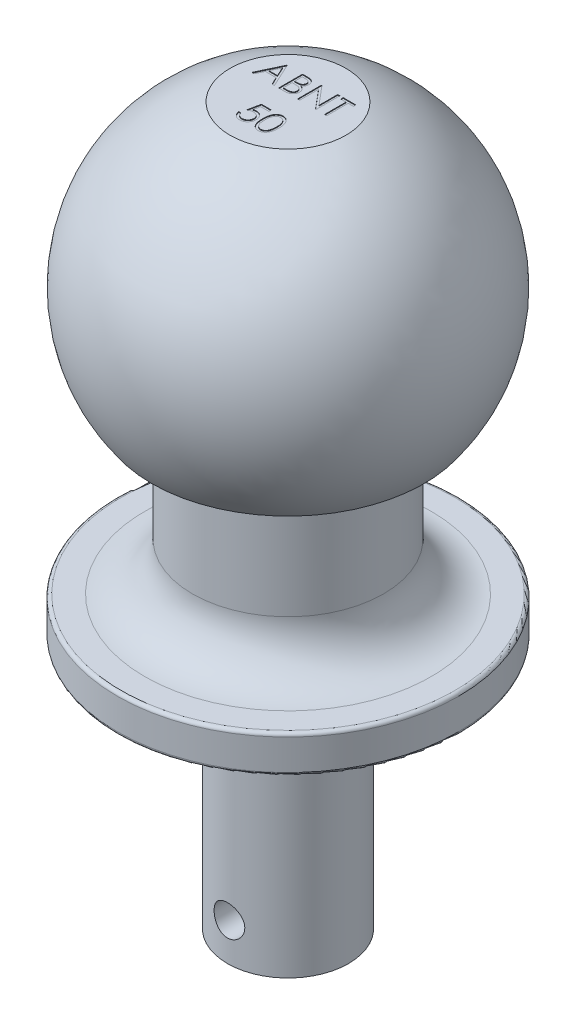
from build123d import *

# Parameters (mm, degrees)
FILETE1_R                = 3
FILETE2_R                = 7
FILETE3_R                = 0.5
FILETE4_R                = 1
CHANFRO1_SIZE            = 1
ESBO_O3_W                = 22.678918952
ESBO_O3_H                = 21.57737146
RESSALTO_EXTRUS_O3_DEPTH = 15
ESBO_O4_R                = 2.25
CORTE_EXTRUS_O1_DEPTH    = 106.463602561
CORTE_EXTRUS_O2_START    = -17.75
ESBO_O5_W                = 26.437139808
ESBO_O5_H                = 26.113155252
ESBO_O5_R                = 8.875
CORTE_EXTRUS_O2_DEPTH    = 17.75
CORTE_EXTRUS_O3_DEPTH    = 0.1


with BuildPart() as part:
    # Esboço1 → Revolução1 (revolve)
    with BuildSketch(Plane.XY, mode=Mode.PRIVATE) as revolu_o1_sk:
        with BuildLine():
            Line((8.5, 8.996138417), (0, 8.996138417))
            Line((0, 8.996138417), (0, -96.003861583))
            Line((0, -96.003861583), (8.875, -96.003861583))
            Line((8.875, -96.003861583), (8.875, -65.003861583))
            Line((8.875, -65.003861583), (9, -65.003861583))
            Line((9, -65.003861583), (9, -59.003861583))
            Line((9, -59.003861583), (25, -59.003861583))
            Line((25, -59.003861583), (25, -53.503861583))
            Line((25, -53.503861583), (14, -53.503861583))
            Line((14, -53.503861583), (14, -29.503861583))
            Line((14, -29.503861583), (19.970638945, -29.503861583))
            ThreePointArc((19.970638945, -29.503861583), (23.929846164, -7.365487157), (8.5, 8.996138417))
        make_face()
    revolve(revolu_o1_sk.sketch.rotate(Axis((0, 76.868050941, 0), (0, -1, 0)), 90), axis=Axis((0, 76.868050941, 0), (0, -1, 0)))

    # Filete1
    filete1_edges = [part.edges().sort_by_distance(p)[0] for p in [
        (0, -29.503861583, -14),
    ]]
    fillet(filete1_edges, radius=FILETE1_R)

    # Filete2
    filete2_edges = [part.edges().sort_by_distance(p)[0] for p in [
        (0, -53.503861583, -14),
    ]]
    fillet(filete2_edges, radius=FILETE2_R)

    # Filete3
    filete3_edges = [part.edges().sort_by_distance(p)[0] for p in [
        (0, -53.503861583, -25),
        (0, -59.003861583, -25),
    ]]
    fillet(filete3_edges, radius=FILETE3_R)

    # Filete4
    filete4_edges = [part.edges().sort_by_distance(p)[0] for p in [
        (0, -59.003861583, -9),
    ]]
    fillet(filete4_edges, radius=FILETE4_R)

    # Chanfro1
    chanfro1_edges = [part.edges().sort_by_distance(p)[0] for p in [
        (0, -96.003861583, -8.875),
    ]]
    chamfer(chanfro1_edges, length=CHANFRO1_SIZE)

    # Esboço3 → Ressalto-extrusão3 (add)
    with BuildSketch(Plane.XZ.offset(96.003861583)):
        Rectangle(ESBO_O3_W, ESBO_O3_H)
    extrude(amount=-RESSALTO_EXTRUS_O3_DEPTH)

    # Esboço4 → Corte-extrusão1 (cut, through all)
    with BuildSketch(Plane.XY.offset(10.78868573)):
        with Locations((0, -90.503861583)):
            Circle(ESBO_O4_R)
    extrude(amount=-CORTE_EXTRUS_O1_DEPTH, mode=Mode.SUBTRACT)

    # Esboço5 → Corte-extrusão2 (cut)
    with BuildSketch(Plane.XZ.offset(96.003861583).offset(CORTE_EXTRUS_O2_START)):
        Rectangle(ESBO_O5_W, ESBO_O5_H)
        with Locations(Location((0, 0, 0), (0, 0, 90))):
            Circle(ESBO_O5_R, mode=Mode.SUBTRACT)
    extrude(amount=CORTE_EXTRUS_O2_DEPTH, mode=Mode.SUBTRACT)

    # Esboço2 → Corte-extrusão3 (cut)
    # profile 1 of 6: a face of its own
    with BuildSketch(Plane(origin=(0, 8.996138417, 0), x_dir=(1, 0, 0), z_dir=(0, 1, 0))):
        Polygon((-4.684544015, 4.57411413), (-3.0691594, 1.07411413), (-3.410605714, 1.07411413), (-3.928033598, 2.195909001), (-5.51467222, 2.195909001), (-6.046823662, 1.07411413), (-6.38967222, 1.07411413), (-4.72941581, 4.57411413), align=None)
        Polygon((-4.710485521, 3.891922623), (-5.344299624, 2.55488336), (-4.093498342, 2.55488336), align=None, mode=Mode.SUBTRACT)
    # profile 2 of 6: a face of its own
    with BuildSketch(Plane(origin=(0, 8.996138417, 0), x_dir=(1, 0, 0), z_dir=(0, 1, 0))):
        with BuildLine():
            Line((-2.440954271, 4.57411413), (-1.758061643, 4.57411413))
            add(Edge.make_bspline(
                [(-1.758061643, 4.57411413), (-1.724633165, 4.573938379), (-1.659840455, 4.573597731), (-1.565621013, 4.5683146), (-1.477372202, 4.56111093), (-1.39506843, 4.549680838), (-1.318747727, 4.53588906), (-1.24818009, 4.519187244), (-1.183589918, 4.499160631), (-1.106477182, 4.467314349), (-1.018556521, 4.419991181), (-0.923358128, 4.350062616), (-0.841953889, 4.264530153), (-0.771767571, 4.168047497), (-0.715966452, 4.061911726), (-0.675597154, 3.948652537), (-0.650039279, 3.829730795), (-0.647410845, 3.748087617), (-0.646082477, 3.706826469)],
                knots=[0, 0, 0, 0, 1.001505555, 1.941167018, 2.826882275, 3.653841531, 4.429895133, 5.150066043, 5.825578002, 6.45369114, 7.647487171, 8.808567382, 9.977351308, 11.170798116, 12.373658725, 13.556498008, 14.765093433, 16, 16, 16, 16], degree=3))
            add(Edge.make_bspline(
                [(-0.646082477, 3.706826469), (-0.647175695, 3.668173914), (-0.649323972, 3.592217997), (-0.669866732, 3.481123887), (-0.7020274, 3.375372669), (-0.746732649, 3.275350283), (-0.804834645, 3.18331667), (-0.873692964, 3.098529404), (-0.956769767, 3.024578347), (-1.019013007, 2.983235444), (-1.050629752, 2.962235123)],
                knots=[0, 0, 0, 0, 1.044552857, 2.05264487, 3.044412934, 4.028983338, 5.005914585, 5.980388656, 6.974128949, 8, 8, 8, 8], degree=3))
            add(Edge.make_bspline(
                [(-1.050629752, 2.962235123), (-1.010869325, 2.946970124), (-0.934797777, 2.9177644), (-0.830111765, 2.866128936), (-0.73991692, 2.809966826), (-0.663519774, 2.748634975), (-0.598182119, 2.682526165), (-0.541129177, 2.61067105), (-0.492447803, 2.532132292), (-0.45073488, 2.447728757), (-0.418186124, 2.358322289), (-0.393810219, 2.264751513), (-0.37984277, 2.167351957), (-0.377855129, 2.101066578), (-0.376851707, 2.067603713)],
                knots=[0, 0, 0, 0, 1.27268992, 2.434971085, 3.483601985, 4.442670788, 5.356604649, 6.2567628, 7.179492994, 8.113709626, 9.066344395, 10.018646069, 10.999752585, 12, 12, 12, 12], degree=3))
            add(Edge.make_bspline(
                [(-0.376851707, 2.067603713), (-0.377828553, 2.033436841), (-0.379750525, 1.966212563), (-0.393930497, 1.867457428), (-0.417939604, 1.773082482), (-0.45101075, 1.682477299), (-0.494173065, 1.595817164), (-0.546701029, 1.5130039), (-0.609332593, 1.43486957), (-0.679395462, 1.360545947), (-0.758657607, 1.293718159), (-0.844173362, 1.234202453), (-0.937019682, 1.185256391), (-1.035671676, 1.144140369), (-1.141235992, 1.112733171), (-1.2532386, 1.090760597), (-1.371582902, 1.07595556), (-1.452792653, 1.074738355), (-1.494439848, 1.07411413)],
                knots=[0, 0, 0, 0, 0.978564426, 1.925352924, 2.850884081, 3.763762016, 4.682927383, 5.618979971, 6.567305752, 7.547517671, 8.540179244, 9.531824382, 10.526200242, 11.540722885, 12.589160233, 13.674978461, 14.80764778, 16, 16, 16, 16], degree=3))
            Line((-1.494439848, 1.07411413), (-2.440954271, 1.07411413))
            Line((-2.440954271, 1.07411413), (-2.440954271, 4.57411413))
        make_face()
        with BuildLine():
            Line((-2.126851707, 4.215139771), (-2.126851707, 3.093344899))
            Line((-2.126851707, 3.093344899), (-1.915814047, 3.093344899))
            add(Edge.make_bspline(
                [(-1.915814047, 3.093344899), (-1.884965252, 3.093744822), (-1.825359092, 3.094517555), (-1.739039196, 3.096731072), (-1.658914178, 3.102929115), (-1.585122345, 3.109125377), (-1.517779901, 3.119199965), (-1.457036039, 3.131192088), (-1.401937442, 3.143874993), (-1.338397897, 3.16544448), (-1.266324948, 3.197322155), (-1.189491844, 3.246793991), (-1.121757374, 3.305718344), (-1.064560187, 3.373709306), (-1.017748716, 3.448575492), (-0.985235001, 3.529122372), (-0.963187717, 3.613342504), (-0.961196186, 3.671160757), (-0.960185041, 3.700516373)],
                knots=[0, 0, 0, 0, 1.156816544, 2.235205308, 3.236616184, 4.169592532, 5.011045266, 5.787822928, 6.49130361, 7.128639758, 8.301311294, 9.436451833, 10.541879658, 11.654887649, 12.756523258, 13.837046038, 14.901820046, 16, 16, 16, 16], degree=3))
            add(Edge.make_bspline(
                [(-0.960185041, 3.700516373), (-0.960711221, 3.719942145), (-0.961743381, 3.758047917), (-0.970196683, 3.813597271), (-0.984564258, 3.865841024), (-1.003018551, 3.915495134), (-1.02880724, 3.961006984), (-1.059170703, 4.00395018), (-1.095856393, 4.042862298), (-1.137613706, 4.079231797), (-1.185622329, 4.111476324), (-1.239853621, 4.139717088), (-1.301041298, 4.162457864), (-1.368154153, 4.182374017), (-1.44222524, 4.196362311), (-1.522399794, 4.208015698), (-1.609334513, 4.21394844), (-1.669479615, 4.214733803), (-1.700569656, 4.215139771)],
                knots=[0, 0, 0, 0, 0.91205012, 1.789085906, 2.630437955, 3.453916878, 4.269457761, 5.079663411, 5.91843418, 6.774407191, 7.675494373, 8.627863946, 9.638891023, 10.736472738, 11.911756761, 13.175263542, 14.539845004, 16, 16, 16, 16], degree=3))
            Line((-1.700569656, 4.215139771), (-2.126851707, 4.215139771))
        make_face(mode=Mode.SUBTRACT)
        with BuildLine():
            Line((-2.126851707, 2.73437054), (-2.126851707, 1.433088489))
            Line((-2.126851707, 1.433088489), (-1.679536002, 1.433088489))
            add(Edge.make_bspline(
                [(-1.679536002, 1.433088489), (-1.647517076, 1.433472236), (-1.585804818, 1.434211859), (-1.496703588, 1.436626413), (-1.414120484, 1.442118689), (-1.338432348, 1.450764538), (-1.268821895, 1.460142988), (-1.206124192, 1.472754269), (-1.149830999, 1.487203229), (-1.084556691, 1.509537401), (-1.011053183, 1.544233872), (-0.931842326, 1.596548099), (-0.861416108, 1.658871406), (-0.801610849, 1.731002321), (-0.752597861, 1.809433648), (-0.716942406, 1.892578997), (-0.694951549, 1.979064525), (-0.69228938, 2.038031237), (-0.690954271, 2.067603713)],
                knots=[0, 0, 0, 0, 1.160039823, 2.235823828, 3.228722157, 4.157150951, 4.99529583, 5.772374946, 6.472645482, 7.099169577, 8.269452708, 9.405989375, 10.527446681, 11.663510218, 12.788923519, 13.866172445, 14.929861265, 16, 16, 16, 16], degree=3))
            add(Edge.make_bspline(
                [(-0.690954271, 2.067603713), (-0.691230376, 2.086097054), (-0.691778131, 2.122785435), (-0.700038746, 2.176701254), (-0.712052616, 2.228927128), (-0.727584049, 2.279604868), (-0.750203517, 2.327818245), (-0.776610062, 2.374520804), (-0.807571463, 2.419774284), (-0.855815629, 2.476986537), (-0.925987614, 2.54290355), (-1.025694389, 2.607441052), (-1.139066687, 2.659488859), (-1.22129418, 2.681588336), (-1.263770778, 2.693004354)],
                knots=[0, 0, 0, 0, 0.723448775, 1.435228256, 2.130040452, 2.821711965, 3.505591119, 4.210454504, 4.921174351, 5.648778258, 7.137944449, 8.670945889, 10.280296675, 12, 12, 12, 12], degree=3))
            add(Edge.make_bspline(
                [(-1.263770778, 2.693004354), (-1.280799874, 2.696459438), (-1.317722466, 2.703950773), (-1.377930046, 2.711858476), (-1.446665915, 2.718903536), (-1.524088793, 2.724114694), (-1.610296634, 2.729501237), (-1.705473552, 2.731596058), (-1.809230867, 2.734095318), (-1.881223239, 2.734276453), (-1.918618534, 2.73437054)],
                knots=[0, 0, 0, 0, 0.634451884, 1.375622551, 2.216452059, 3.157844607, 4.20941857, 5.370758133, 6.634282058, 8, 8, 8, 8], degree=3))
            Line((-1.918618534, 2.73437054), (-2.126851707, 2.73437054))
        make_face(mode=Mode.SUBTRACT)
    # profile 3 of 6: a face of its own
    with BuildSketch(Plane(origin=(0, 8.996138417, 0), x_dir=(1, 0, 0), z_dir=(0, 1, 0))):
        Polygon((0.341097011, 1.07411413), (0.341097011, 4.57411413), (0.407002459, 4.57411413), (2.719302139, 1.819406598), (2.719302139, 4.57411413), (3.033404703, 4.57411413), (3.033404703, 1.07411413), (2.96189028, 1.07411413), (0.655199575, 3.822511566), (0.655199575, 1.07411413), align=None)
    # profile 4 of 6: a face of its own
    with BuildSketch(Plane(origin=(0, 8.996138417, 0), x_dir=(1, 0, 0), z_dir=(0, 1, 0))):
        Polygon((3.526994447, 4.215139771), (3.526994447, 4.57411413), (5.366738036, 4.57411413), (5.366738036, 4.215139771), (4.603917523, 4.215139771), (4.603917523, 1.07411413), (4.289814959, 1.07411413), (4.289814959, 4.215139771), align=None)
    # profile 5 of 6: a face of its own
    with BuildSketch(Plane(origin=(0, 8.996138417, 0), x_dir=(1, 0, 0), z_dir=(0, 1, 0))):
        with BuildLine():
            Line((-0.197364528, -2.259219204), (-0.197364528, -2.618193563))
            Line((-0.197364528, -2.618193563), (-1.387869335, -2.618193563))
            Line((-1.387869335, -2.618193563), (-1.576471098, -3.538766479))
            add(Edge.make_bspline(
                [(-1.576471098, -3.538766479), (-1.539415224, -3.528536208), (-1.467625328, -3.508716674), (-1.361665467, -3.486710903), (-1.261073264, -3.473445459), (-1.195797893, -3.471634149), (-1.164211483, -3.470757665)],
                knots=[0, 0, 0, 0, 1.100273476, 2.13160584, 3.095893838, 4, 4, 4, 4], degree=3))
            add(Edge.make_bspline(
                [(-1.164211483, -3.470757665), (-1.125127743, -3.471603601), (-1.048279346, -3.473266922), (-0.935840399, -3.489238771), (-0.828507506, -3.514378686), (-0.726505136, -3.549499208), (-0.629644585, -3.594408941), (-0.538817023, -3.650508881), (-0.45265911, -3.716042212), (-0.372716516, -3.791387224), (-0.300192208, -3.874308841), (-0.236426219, -3.963466712), (-0.182263628, -4.057994374), (-0.138702873, -4.158794983), (-0.103918539, -4.264754136), (-0.080766544, -4.376986719), (-0.065349835, -4.494434839), (-0.063627449, -4.574739409), (-0.062749143, -4.615689556)],
                knots=[0, 0, 0, 0, 1.052922333, 2.070308379, 3.05430497, 4.020497103, 4.973039431, 5.925935799, 6.892292201, 7.88610001, 8.88166317, 9.857072816, 10.836096531, 11.812156883, 12.81219415, 13.836441305, 14.89672472, 16, 16, 16, 16], degree=3))
            add(Edge.make_bspline(
                [(-0.062749143, -4.615689556), (-0.063414218, -4.644211777), (-0.064735381, -4.700870764), (-0.071453969, -4.785014965), (-0.084389685, -4.867377798), (-0.101757409, -4.94797019), (-0.124299827, -5.026639562), (-0.151588881, -5.10361109), (-0.184984908, -5.178405697), (-0.221616284, -5.251731092), (-0.262862762, -5.321929599), (-0.308641269, -5.387578585), (-0.35700676, -5.449662867), (-0.409048146, -5.5075166), (-0.465249141, -5.560759618), (-0.524929108, -5.609707899), (-0.587611827, -5.65518923), (-0.654267069, -5.695357425), (-0.723409552, -5.732320381), (-0.796037769, -5.762643918), (-0.870498469, -5.789754446), (-0.947863345, -5.811363974), (-1.027957158, -5.828296528), (-1.110911933, -5.839797129), (-1.196292603, -5.848173567), (-1.254167616, -5.848697923), (-1.283402188, -5.848962793)],
                knots=[0, 0, 0, 0, 1.056347294, 2.098418968, 3.122841568, 4.141288669, 5.149314143, 6.15115421, 7.162517403, 8.180376062, 9.185164535, 10.17417709, 11.141909838, 12.097768115, 13.052685741, 14.0056014, 14.954263652, 15.917497458, 16.885230207, 17.854509472, 18.828990115, 19.81800267, 20.826176721, 21.857883937, 22.917946725, 24, 24, 24, 24], degree=3))
            add(Edge.make_bspline(
                [(-1.283402188, -5.848962793), (-1.318276369, -5.848271955), (-1.386887199, -5.846912813), (-1.487407767, -5.832694328), (-1.584122372, -5.812330412), (-1.676252473, -5.781694142), (-1.764623737, -5.743306847), (-1.848046455, -5.694790676), (-1.928652231, -5.639811572), (-2.003164268, -5.574931219), (-2.072320381, -5.504015537), (-2.13422689, -5.427057896), (-2.189360467, -5.345328454), (-2.236838214, -5.2584303), (-2.277336235, -5.166591769), (-2.309151223, -5.069468768), (-2.334829578, -4.967568764), (-2.345692999, -4.897415253), (-2.351210682, -4.861783306)],
                knots=[0, 0, 0, 0, 1.0467383, 2.05933395, 3.04377827, 4.011590433, 4.970194871, 5.932262533, 6.905835911, 7.896367577, 8.894135286, 9.877477877, 10.858688626, 11.851381753, 12.8477658, 13.868841284, 14.917554742, 16, 16, 16, 16], degree=3))
            Line((-2.351210682, -4.861783306), (-2.037108118, -4.861783306))
            add(Edge.make_bspline(
                [(-2.037108118, -4.861783306), (-2.02937956, -4.895159759), (-2.014524844, -4.959311154), (-1.981919095, -5.049442495), (-1.942053219, -5.129761719), (-1.894648871, -5.201331302), (-1.838098841, -5.263740299), (-1.773569412, -5.319357361), (-1.701221688, -5.36953249), (-1.620828459, -5.411355258), (-1.53601538, -5.447024011), (-1.44724817, -5.470775706), (-1.356943823, -5.487476599), (-1.295865453, -5.48914836), (-1.265173021, -5.489988434)],
                knots=[0, 0, 0, 0, 1.136247022, 2.183929868, 3.172523383, 4.106158343, 5.02341133, 5.958108904, 6.928429099, 7.938127109, 8.96079061, 9.975095812, 10.982467395, 12, 12, 12, 12], degree=3))
            add(Edge.make_bspline(
                [(-1.265173021, -5.489988434), (-1.235214577, -5.489167657), (-1.176226155, -5.487551538), (-1.089414768, -5.475112526), (-1.005601894, -5.455954955), (-0.925614537, -5.4272851), (-0.848052998, -5.392440381), (-0.774879227, -5.347725306), (-0.70397635, -5.296265287), (-0.637548216, -5.237308657), (-0.576708767, -5.172338962), (-0.522952646, -5.102861569), (-0.478175733, -5.028744722), (-0.440441624, -4.95127157), (-0.411788325, -4.869593012), (-0.391347344, -4.784091837), (-0.379344285, -4.694556857), (-0.377693105, -4.633487547), (-0.376851707, -4.602368242)],
                knots=[0, 0, 0, 0, 1.027316725, 2.022795036, 3.002884548, 3.971462791, 4.93288096, 5.914575861, 6.907176829, 7.935150275, 8.956128384, 9.956726525, 10.942570165, 11.921478529, 12.907843606, 13.90538589, 14.932640048, 16, 16, 16, 16], degree=3))
            add(Edge.make_bspline(
                [(-0.376851707, -4.602368242), (-0.377510187, -4.574292491), (-0.378799067, -4.519338201), (-0.389329637, -4.438938995), (-0.407646609, -4.362865953), (-0.433070489, -4.290751719), (-0.465349997, -4.222528276), (-0.504796309, -4.158125216), (-0.552149707, -4.098391383), (-0.606241596, -4.043298829), (-0.665499637, -3.992453954), (-0.730943379, -3.949109868), (-0.801203306, -3.91264595), (-0.875432906, -3.881177952), (-0.955397804, -3.858577207), (-1.039514437, -3.841609321), (-1.128691145, -3.831793959), (-1.189661833, -3.83043207), (-1.221002348, -3.829732024)],
                knots=[0, 0, 0, 0, 1.045622112, 2.046656509, 3.013763289, 3.955457236, 4.890082067, 5.820317437, 6.762574623, 7.722996705, 8.69280354, 9.665887285, 10.63943826, 11.638615906, 12.663482002, 13.728887084, 14.832589034, 16, 16, 16, 16], degree=3))
            add(Edge.make_bspline(
                [(-1.221002348, -3.829732024), (-1.248131277, -3.830312615), (-1.304145632, -3.831511389), (-1.390068459, -3.840337886), (-1.480360182, -3.85457718), (-1.574674678, -3.874163428), (-1.673295186, -3.899794504), (-1.776013587, -3.930509005), (-1.883045853, -3.967231004), (-1.955163578, -3.994963217), (-1.992236323, -4.009219204)],
                knots=[0, 0, 0, 0, 0.817624296, 1.688186739, 2.600797293, 3.572016777, 4.590301741, 5.671205678, 6.80286297, 8, 8, 8, 8], degree=3))
            Line((-1.992236323, -4.009219204), (-1.633261964, -2.259219204))
            Line((-1.633261964, -2.259219204), (-0.197364528, -2.259219204))
        make_face()
    # profile 6 of 6: a face of its own
    with BuildSketch(Plane(origin=(0, 8.996138417, 0), x_dir=(1, 0, 0), z_dir=(0, 1, 0))):
        with BuildLine():
            add(Edge.make_bspline(
                [(0.296225216, -4.010621447), (0.296553234, -3.95452406), (0.297190414, -3.845554075), (0.304278835, -3.686769433), (0.316054177, -3.537809144), (0.33219155, -3.398666078), (0.35182953, -3.269304314), (0.378045017, -3.150069557), (0.407857819, -3.04040995), (0.442410265, -2.939967901), (0.481398054, -2.847390198), (0.523832315, -2.760964997), (0.571397109, -2.680823065), (0.621374022, -2.605685274), (0.675786094, -2.53678158), (0.733084884, -2.473138917), (0.795506761, -2.416228167), (0.860929769, -2.364381864), (0.929946233, -2.318932393), (1.0005889, -2.278899654), (1.073344005, -2.244699787), (1.148410188, -2.217809351), (1.225112746, -2.195598504), (1.303719813, -2.180409556), (1.384361177, -2.170852648), (1.438792612, -2.16993898), (1.466397491, -2.169475614)],
                knots=[0, 0, 0, 0, 1.646270934, 3.197905019, 4.663502075, 6.030701355, 7.308322542, 8.50163776, 9.611534131, 10.641858119, 11.616356847, 12.558055219, 13.465016945, 14.349605745, 15.204443733, 16.039544428, 16.859896111, 17.680448484, 18.487036065, 19.28249412, 20.06191084, 20.843045899, 21.620316918, 22.403196591, 23.190181807, 24, 24, 24, 24], degree=3))
            add(Edge.make_bspline(
                [(1.466397491, -2.169475614), (1.49423297, -2.169963429), (1.549588979, -2.17093354), (1.631429354, -2.180257483), (1.711379036, -2.195728606), (1.789097174, -2.21764958), (1.865222161, -2.244845257), (1.939158569, -2.278932374), (2.01136565, -2.318611241), (2.080695938, -2.365235119), (2.147910553, -2.417217395), (2.211358516, -2.475980064), (2.271045602, -2.540929783), (2.327720907, -2.611371647), (2.379776505, -2.688656732), (2.429349937, -2.771440841), (2.473721973, -2.861171706), (2.516456648, -2.956352174), (2.553343635, -3.059615833), (2.58660988, -3.170380593), (2.613488848, -3.28995478), (2.635878121, -3.417711026), (2.653223017, -3.554118509), (2.665855659, -3.698884824), (2.672528744, -3.852105215), (2.673785445, -3.956863064), (2.674430344, -4.010621447)],
                knots=[0, 0, 0, 0, 0.810914788, 1.612654377, 2.396697861, 3.181598691, 3.963628158, 4.749916497, 5.551656086, 6.361998678, 7.18212741, 8.025565596, 8.878627764, 9.750805457, 10.657531673, 11.591944965, 12.560506719, 13.57287815, 14.630710178, 15.753379473, 16.941251878, 18.199788006, 19.531962791, 20.947069417, 22.433333509, 24, 24, 24, 24], degree=3))
            add(Edge.make_bspline(
                [(2.674430344, -4.010621447), (2.673778759, -4.064145355), (2.672509174, -4.168434507), (2.665930467, -4.320965482), (2.652971836, -4.464963526), (2.636761847, -4.600773988), (2.614310884, -4.727831607), (2.586705718, -4.846576055), (2.556055395, -4.957520127), (2.518220601, -5.059754939), (2.476809891, -5.154706662), (2.431754695, -5.24337381), (2.383484869, -5.326540103), (2.330896124, -5.40353985), (2.27484271, -5.474918507), (2.214124922, -5.539416129), (2.150454336, -5.598586801), (2.083041921, -5.651238429), (2.012630369, -5.697323233), (1.940671292, -5.738537084), (1.865887909, -5.771769779), (1.789974956, -5.80030482), (1.71184659, -5.822105272), (1.6316002, -5.837179127), (1.549643964, -5.847750976), (1.494242399, -5.848557455), (1.466397491, -5.848962793)],
                knots=[0, 0, 0, 0, 1.561518951, 3.042555995, 4.452378317, 5.7783523, 7.031515105, 8.214008947, 9.334062868, 10.386615937, 11.391082383, 12.354592575, 13.286541444, 14.194233754, 15.072674879, 15.931287219, 16.775624067, 17.606195743, 18.42308326, 19.229000347, 20.022332153, 20.807536673, 21.593273796, 22.3848459, 23.188221202, 24, 24, 24, 24], degree=3))
            add(Edge.make_bspline(
                [(1.466397491, -5.848962793), (1.438793377, -5.848496438), (1.384363453, -5.847576876), (1.303711027, -5.838063145), (1.225428584, -5.822767641), (1.14912983, -5.801351037), (1.074423315, -5.775136201), (1.002327028, -5.740982517), (0.932039344, -5.701648448), (0.863747788, -5.656853027), (0.798735627, -5.605531344), (0.736637022, -5.548767055), (0.679012003, -5.485143644), (0.625377907, -5.415665721), (0.574403819, -5.340972478), (0.527514446, -5.260044105), (0.484143592, -5.173201495), (0.444500101, -5.079883584), (0.409351437, -4.978728656), (0.378303729, -4.868579478), (0.353789572, -4.748463842), (0.332806617, -4.619346475), (0.315882234, -4.480672544), (0.304327908, -4.332366766), (0.297186593, -4.174521557), (0.296551523, -4.066251783), (0.296225216, -4.010621447)],
                knots=[0, 0, 0, 0, 0.810891512, 1.598919785, 2.382837074, 3.152667961, 3.926044502, 4.706494248, 5.493654104, 6.291793342, 7.103789334, 7.925228297, 8.761435821, 9.622817696, 10.50288917, 11.416980706, 12.369136599, 13.353924996, 14.394355917, 15.514179734, 16.714354668, 17.994756427, 19.357759367, 20.818452758, 22.365282078, 24, 24, 24, 24], degree=3))
        make_face()
        with BuildLine():
            add(Edge.make_bspline(
                [(0.61032778, -4.009219204), (0.610447227, -4.055967902), (0.61067905, -4.146697947), (0.616735251, -4.278541208), (0.624985483, -4.401511537), (0.63562678, -4.515765074), (0.651429729, -4.620915086), (0.669136516, -4.717684769), (0.690684606, -4.805562006), (0.716179624, -4.885149817), (0.745218721, -4.957798885), (0.776924584, -5.025400101), (0.810985307, -5.088752037), (0.849104458, -5.147285645), (0.890619521, -5.201191809), (0.93459278, -5.251424642), (0.982665364, -5.296221623), (1.049169107, -5.349948478), (1.136965581, -5.405467612), (1.247586037, -5.453813702), (1.361254488, -5.484196158), (1.438405738, -5.488059914), (1.476914318, -5.489988434)],
                knots=[0, 0, 0, 0, 1.459021318, 2.831673884, 4.118529203, 5.306027144, 6.411944654, 7.436330062, 8.375795394, 9.233974572, 10.042671642, 10.816086306, 11.563610507, 12.285937304, 12.993564865, 13.685989202, 14.367179055, 15.041617293, 16.353048772, 17.594441528, 18.799311195, 20, 20, 20, 20], degree=3))
            add(Edge.make_bspline(
                [(1.476914318, -5.489988434), (1.51567199, -5.488390654), (1.593107313, -5.485198391), (1.706241108, -5.454399653), (1.816071378, -5.407930114), (1.902143319, -5.352982609), (1.967625862, -5.300654279), (2.014542852, -5.256039631), (2.057604901, -5.206083764), (2.098446976, -5.152184468), (2.135906051, -5.093311983), (2.169969189, -5.029749408), (2.201052537, -4.96132023), (2.218761582, -4.913550491), (2.227815761, -4.889127056)],
                knots=[0, 0, 0, 0, 1.353760809, 2.704726607, 4.075137775, 5.516104923, 6.260822281, 7.007110065, 7.778089737, 8.566572457, 9.372053459, 10.217411131, 11.088608312, 12, 12, 12, 12], degree=3))
            add(Edge.make_bspline(
                [(2.227815761, -4.889127056), (2.238367528, -4.857897317), (2.259792142, -4.794487553), (2.287403917, -4.6961239), (2.309149316, -4.592921137), (2.328712682, -4.48549602), (2.342065737, -4.373056319), (2.352813551, -4.255949935), (2.359144238, -4.134088573), (2.359928989, -4.051293581), (2.36032778, -4.009219204)],
                knots=[0, 0, 0, 0, 0.884706709, 1.796334032, 2.740027952, 3.714592787, 4.726048262, 5.777819803, 6.87074269, 8, 8, 8, 8], degree=3))
            add(Edge.make_bspline(
                [(2.36032778, -4.009219204), (2.359777591, -3.967151631), (2.358701303, -3.884858466), (2.354587315, -3.764340286), (2.343963741, -3.649872525), (2.332164622, -3.540962052), (2.314767401, -3.438211749), (2.296009594, -3.340761444), (2.270808382, -3.249818419), (2.243888607, -3.163958838), (2.213078211, -3.084158183), (2.179162477, -3.010044397), (2.142940718, -2.941259672), (2.103598478, -2.87799273), (2.061602795, -2.819960188), (2.015845245, -2.768325593), (1.968140873, -2.721488625), (1.901323687, -2.668026056), (1.813849397, -2.61351436), (1.70500375, -2.5633486), (1.591733105, -2.534540308), (1.515159651, -2.530478621), (1.476914318, -2.528449973)],
                knots=[0, 0, 0, 0, 1.31362396, 2.569729283, 3.763502607, 4.902122613, 5.988968491, 7.01645872, 7.998833611, 8.933434873, 9.825090667, 10.667526885, 11.477055099, 12.250526234, 12.991942729, 13.710640831, 14.402115721, 15.076753259, 16.378508321, 17.609869233, 18.806226677, 20, 20, 20, 20], degree=3))
            add(Edge.make_bspline(
                [(1.476914318, -2.528449973), (1.438203726, -2.53048142), (1.360712021, -2.534548014), (1.246264066, -2.563241267), (1.136559714, -2.613254233), (1.04931674, -2.668206606), (0.982452953, -2.720544917), (0.93537026, -2.765931371), (0.891224088, -2.815577626), (0.850556387, -2.86997954), (0.812467104, -2.928444908), (0.777486092, -2.991433672), (0.745968762, -3.059265037), (0.716884226, -3.131881472), (0.691311438, -3.211462416), (0.670217474, -3.29923141), (0.650730421, -3.395693302), (0.636935152, -3.50141281), (0.624671397, -3.615694963), (0.616790049, -3.738972281), (0.610658791, -3.871036662), (0.610440327, -3.96223582), (0.61032778, -4.009219204)],
                knots=[0, 0, 0, 0, 1.207732386, 2.417664972, 3.655092373, 4.956220595, 5.625982001, 6.301752483, 6.994047911, 7.697131622, 8.419323945, 9.170223765, 9.943494443, 10.752040957, 11.610060368, 12.549350801, 13.567764191, 14.679664412, 15.874934091, 17.154273443, 18.533957287, 20, 20, 20, 20], degree=3))
        make_face(mode=Mode.SUBTRACT)
    extrude(amount=-CORTE_EXTRUS_O3_DEPTH, mode=Mode.SUBTRACT)


solid = part.part
